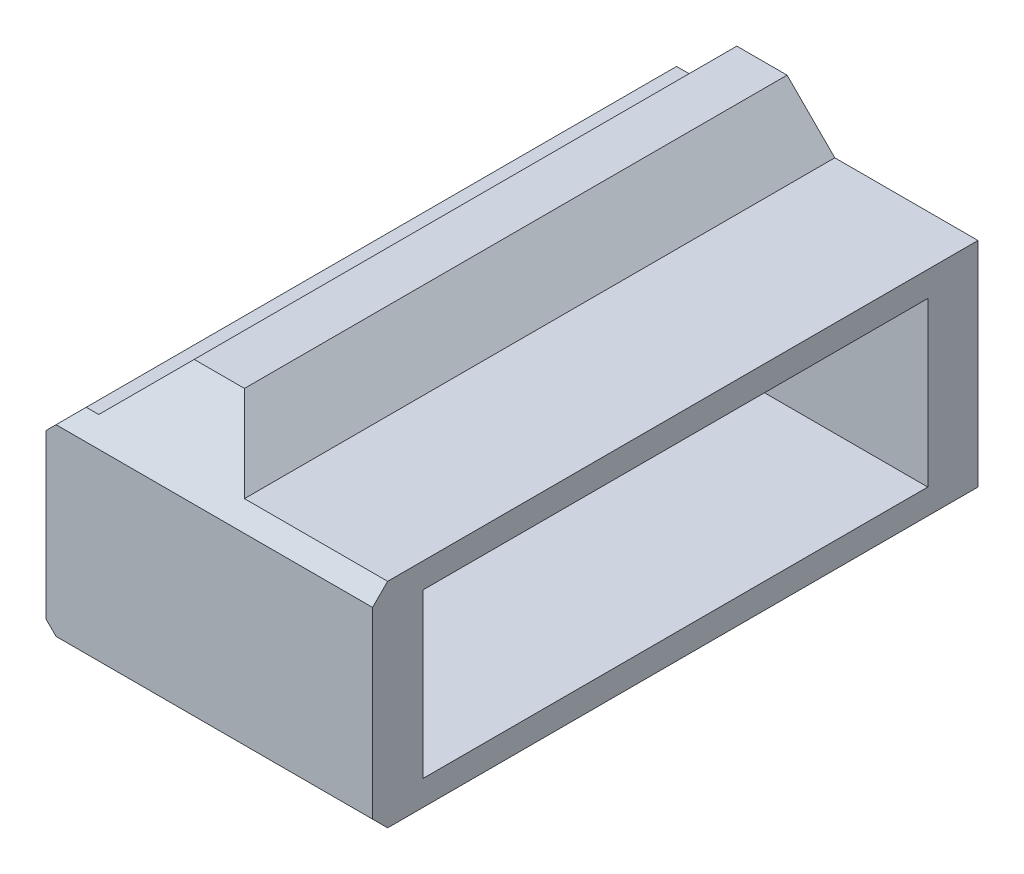
from build123d import *

# Parameters (mm, degrees)
BOSS_EXTRUDE1_DEPTH = 24.1
SKETCH2_W           = 20.1
SKETCH2_H           = 6.5
CUT_EXTRUDE1_DEPTH  = 9.65
SKETCH3_W           = 1.5
SKETCH3_H           = 3
CUT_EXTRUDE2_DEPTH  = 28.965916756
SKETCH4_R           = 3
CUT_EXTRUDE3_DEPTH  = 2.8
CUT_EXTRUDE4_DEPTH  = 30.291124936
CHAMFER1_SIZE       = 1


with BuildPart() as part:
    # Sketch1 → Boss-Extrude1 (new body)
    with BuildSketch(Plane.XY):
        Polygon((0, 8.5), (1.5, 8.5), (3.4, 10.4), (5.4, 10.4), (7.3, 8.5), (13, 8.5), (13, 0), (7.3, 0), (5.4, -1.9), (3.4, -1.9), (1.5, 0), (0, 0), align=None)
    extrude(amount=BOSS_EXTRUDE1_DEPTH)

    # Sketch2 → Cut-Extrude1 (cut)
    with BuildSketch(Plane(origin=(13, 0, 0), x_dir=(0, 0, -1), z_dir=(1, 0, 0))):
        with Locations((-12.05, 4.25)):
            Rectangle(SKETCH2_W, SKETCH2_H)
    extrude(amount=-CUT_EXTRUDE1_DEPTH, mode=Mode.SUBTRACT)

    # Sketch3 → Cut-Extrude2 (cut, through all)
    with BuildSketch(Plane(origin=(3.35, 0, 0), x_dir=(0, 0, -1), z_dir=(1, 0, 0))):
        with Locations((-4.75, 4.25)):
            Rectangle(SKETCH3_W, SKETCH3_H)
        with Locations((-19.75, 4.25)):
            Rectangle(SKETCH3_W, SKETCH3_H)
        with Locations((-12.25, 4.25)):
            Rectangle(SKETCH3_W, SKETCH3_H)
    extrude(amount=-CUT_EXTRUDE2_DEPTH, mode=Mode.SUBTRACT)

    # Sketch4 → Cut-Extrude3 (cut)
    with BuildSketch(Plane.ZY):
        with Locations((8, 4.25)):
            Circle(SKETCH4_R)
        with Locations((16.5, 4.25)):
            Circle(SKETCH4_R)
    extrude(amount=-CUT_EXTRUDE3_DEPTH, mode=Mode.SUBTRACT)

    # Sketch5 → Cut-Extrude4 (cut, through all)
    with BuildSketch(Plane.ZY):
        Polygon((24.1, -1.9), (24.1, 0.6), (21.6, -1.9), align=None)
        Polygon((21.6, 10.4), (24.1, 10.4), (24.1, 7.9), align=None)
    extrude(amount=-CUT_EXTRUDE4_DEPTH, mode=Mode.SUBTRACT)

    # Chamfer1
    chamfer1_edges = [part.edges().sort_by_distance(p)[0] for p in [
        (0, 8.5, 11.75),
        (0, 0, 11.75),
    ]]
    chamfer(chamfer1_edges, length=CHAMFER1_SIZE)


solid = part.part
